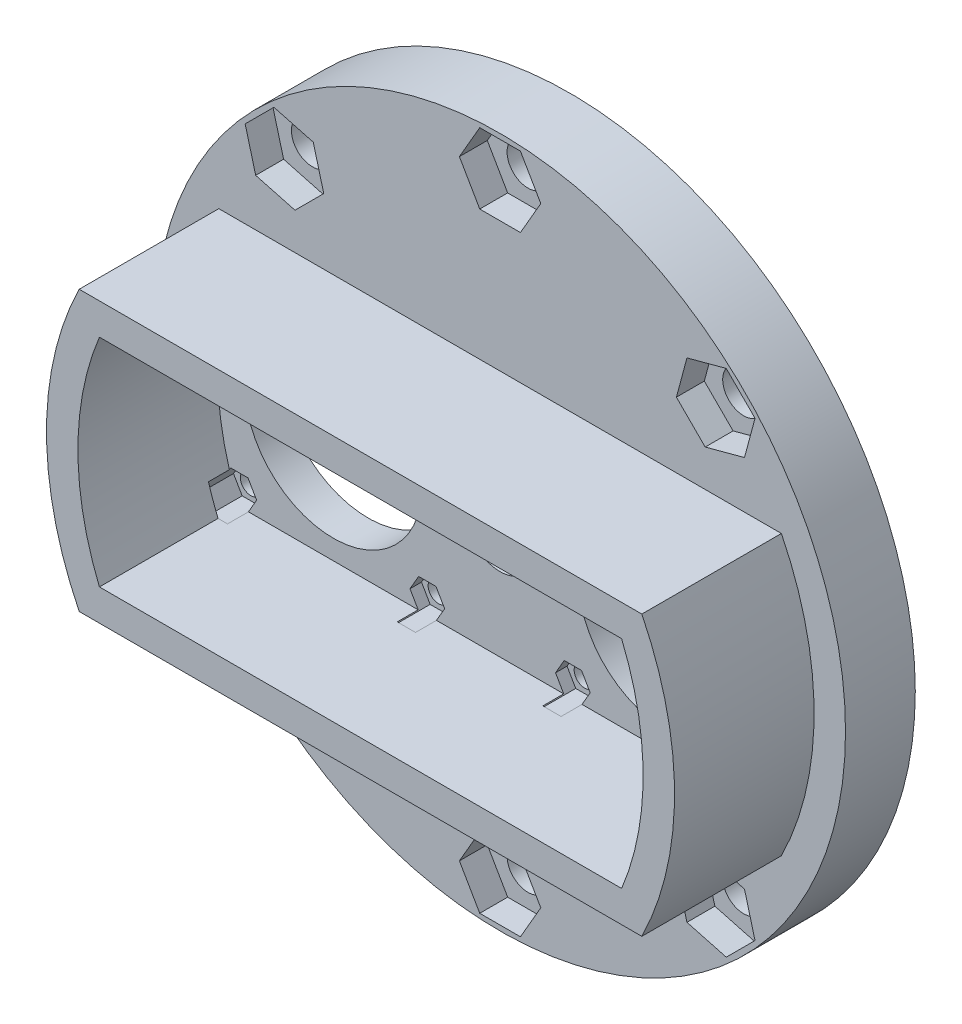
from build123d import *

# Parameters (mm, degrees)
SKETCH2_R               = 49.5
BOSS_EXTRUDE1_DEPTH     = 10
SKETCH1_R               = 1.5
SKETCH1_R_2             = 12.7
CUT_EXTRUDE1_DEPTH      = 5
SKETCH1_12_R            = 4.9
SKETCH1_12_R_2          = 2
CUT_EXTRUDE2_DEPTH      = 45
SKETCH1_13_R            = 1.5
CUT_EXTRUDE3_DEPTH      = 10
BOSS_EXTRUDE2_DEPTH     = 20
SKETCH5_R               = 3
CUT_EXTRUDE4_DEPTH      = 20
SKETCH6_R               = 3
CUT_EXTRUDE5_DEPTH      = 4
CUT_EXTRUDE6_DEPTH      = 3
CUT_EXTRUDE6_DEPTH_BACK = 1.65


with BuildPart() as part:
    # Sketch2 → Boss-Extrude1 (new body)
    with BuildSketch(Plane.XY):
        Circle(SKETCH2_R)
    extrude(amount=BOSS_EXTRUDE1_DEPTH)

    # Sketch1 → Cut-Extrude1 (cut)
    # profile 1 of 2: a face of its own
    with BuildSketch(Plane(origin=(0, 0, 0), x_dir=(-1, 0, 0), z_dir=(0, 0, 1))):
        with BuildLine():
            Line((-7, 14.240786495), (-7, -14.240786495))
            ThreePointArc((-7, -14.240786495), (-23.9, -22.1), (-40.8, -14.240786495))
            Line((-40.8, -14.240786495), (-40.8, 14.240786495))
            ThreePointArc((-40.8, 14.240786495), (-23.9, 22.1), (-7, 14.240786495))
        make_face()
        with Locations(Location((-37.370384182, 13.470384182, 0), (0, 0, 180))):
            Circle(SKETCH1_R, mode=Mode.SUBTRACT)
        with Locations(Location((-10.464971157, 13.435028843, 0), (0, 0, 180))):
            Circle(SKETCH1_R, mode=Mode.SUBTRACT)
        with Locations(Location((-10.464971157, -13.435028843, 0), (0, 0, 180))):
            Circle(SKETCH1_R, mode=Mode.SUBTRACT)
        with Locations(Location((-37.370384182, -13.470384182, 0), (0, 0, 180))):
            Circle(SKETCH1_R, mode=Mode.SUBTRACT)
        with Locations(Location((-23.9, 0, 0), (0, 0, 180))):
            Circle(SKETCH1_R_2, mode=Mode.SUBTRACT)
    # profile 2 of 2: a face of its own
    with BuildSketch(Plane(origin=(0, 0, 0), x_dir=(-1, 0, 0), z_dir=(0, 0, 1))):
        with BuildLine():
            Line((7, 14.240786495), (7, -14.240786495))
            ThreePointArc((7, -14.240786495), (23.9, -22.1), (40.8, -14.240786495))
            Line((40.8, -14.240786495), (40.8, 14.240786495))
            ThreePointArc((40.8, 14.240786495), (23.9, 22.1), (7, 14.240786495))
        make_face()
        with Locations(Location((10.464971157, 13.435028843, 0), (0, 0, 180))):
            Circle(SKETCH1_R, mode=Mode.SUBTRACT)
        with Locations(Location((10.464971157, -13.435028843, 0), (0, 0, 180))):
            Circle(SKETCH1_R, mode=Mode.SUBTRACT)
        with Locations(Location((37.370384182, -13.470384182, 0), (0, 0, 180))):
            Circle(SKETCH1_R, mode=Mode.SUBTRACT)
        with Locations(Location((37.370384182, 13.470384182, 0), (0, 0, 180))):
            Circle(SKETCH1_R, mode=Mode.SUBTRACT)
        with Locations(Location((23.9, 0, 0), (0, 0, 180))):
            Circle(SKETCH1_R_2, mode=Mode.SUBTRACT)
    extrude(amount=CUT_EXTRUDE1_DEPTH, mode=Mode.SUBTRACT)

    # Sketch1<12> → Cut-Extrude2 (cut)
    with BuildSketch(Plane(origin=(0, 0, 0), x_dir=(-1, 0, 0), z_dir=(0, 0, 1))):
        Circle(SKETCH1_12_R)
        with Locations((0, 35)):
            Circle(SKETCH1_12_R_2)
        with BuildLine():
            Line((-11.2, 0), (-23.9, 0))
            Line((-23.9, 0), (-36.6, 0))
            ThreePointArc((-36.6, 0), (-23.9, -12.7), (-11.2, 0))
        make_face()
        with BuildLine():
            Line((-14.919743879, 8.980256121), (-23.9, 0))
            Line((-23.9, 0), (-11.2, 0))
            ThreePointArc((-11.2, 0), (-12.166729937, 4.860079591), (-14.919743879, 8.980256121))
        make_face()
        with BuildLine():
            Line((-32.880256121, 8.980256121), (-23.9, 0))
            Line((-23.9, 0), (-14.919743879, 8.980256121))
            ThreePointArc((-14.919743879, 8.980256121), (-23.9, 12.7), (-32.880256121, 8.980256121))
        make_face()
        with BuildLine():
            Line((-36.6, 0), (-23.9, 0))
            Line((-23.9, 0), (-32.880256121, 8.980256121))
            ThreePointArc((-32.880256121, 8.980256121), (-35.633270063, 4.860079591), (-36.6, 0))
        make_face()
        with BuildLine():
            Line((11.2, 0), (23.9, 0))
            Line((23.9, 0), (36.6, 0))
            ThreePointArc((36.6, 0), (23.9, 12.7), (11.2, 0))
        make_face()
        with BuildLine():
            Line((36.6, 0), (23.9, 0))
            Line((23.9, 0), (11.2, 0))
            ThreePointArc((11.2, 0), (23.9, -12.7), (36.6, 0))
        make_face()
    extrude(amount=CUT_EXTRUDE2_DEPTH, mode=Mode.SUBTRACT)

    # Sketch1<13> → Cut-Extrude3 (cut)
    with BuildSketch(Plane(origin=(0, 0, 0), x_dir=(-1, 0, 0), z_dir=(0, 0, 1))):
        with Locations(Location((-37.370384182, 13.470384182, 0), (0, 0, 180))):
            Circle(SKETCH1_13_R)
        with Locations(Location((-10.464971157, 13.435028843, 0), (0, 0, 180))):
            Circle(SKETCH1_13_R)
        with Locations(Location((-10.464971157, -13.435028843, 0), (0, 0, 180))):
            Circle(SKETCH1_13_R)
        with Locations(Location((-37.370384182, -13.470384182, 0), (0, 0, 180))):
            Circle(SKETCH1_13_R)
        with Locations(Location((10.464971157, 13.435028843, 0), (0, 0, 180))):
            Circle(SKETCH1_13_R)
        with Locations(Location((10.464971157, -13.435028843, 0), (0, 0, 180))):
            Circle(SKETCH1_13_R)
        with Locations(Location((37.370384182, -13.470384182, 0), (0, 0, 180))):
            Circle(SKETCH1_13_R)
        with Locations(Location((37.370384182, 13.470384182, 0), (0, 0, 180))):
            Circle(SKETCH1_13_R)
    extrude(amount=CUT_EXTRUDE3_DEPTH, mode=Mode.SUBTRACT)

    # Sketch4 → Boss-Extrude2 (add)
    with BuildSketch(Plane.XY.offset(10)):
        with BuildLine():
            Line((-40.311288741, -20), (40.311288741, -20))
            ThreePointArc((40.311288741, -20), (45, 0), (40.311288741, 20))
            Line((40.311288741, 20), (-40.311288741, 20))
            ThreePointArc((-40.311288741, 20), (-45, 0), (-40.311288741, -20))
        make_face()
        with BuildLine():
            Line((37.416573868, -15.5), (-37.416573868, -15.5))
            ThreePointArc((-37.416573868, -15.5), (-40.5, 0), (-37.416573868, 15.5))
            Line((-37.416573868, 15.5), (37.416573868, 15.5))
            ThreePointArc((37.416573868, 15.5), (40.5, 0), (37.416573868, -15.5))
        make_face(mode=Mode.SUBTRACT)
    extrude(amount=BOSS_EXTRUDE2_DEPTH)

    # Sketch5 → Cut-Extrude4 (cut)
    with BuildSketch(Plane.XY.offset(10)):
        with Locations((0, 43.7)):
            Circle(SKETCH5_R)
        with Locations((30.900566338, 30.900566338)):
            Circle(SKETCH5_R)
        with Locations((30.900566338, -30.900566338)):
            Circle(SKETCH5_R)
        with Locations((0, -43.7)):
            Circle(SKETCH5_R)
        with Locations((-30.900566338, -30.900566338)):
            Circle(SKETCH5_R)
        with Locations((-30.900566338, 30.900566338)):
            Circle(SKETCH5_R)
    extrude(amount=-CUT_EXTRUDE4_DEPTH, mode=Mode.SUBTRACT)

    # Sketch6 → Cut-Extrude5 (cut)
    # profile 1 of 6: a face of its own
    with BuildSketch(Plane.XY.offset(10)):
        Polygon((-2.915618859, 38.65), (2.915618859, 38.65), (5.831237719, 43.7), (2.915618859, 48.75), (-2.915618859, 48.75), (-5.831237719, 43.7), align=None)
        with Locations((0, 43.7)):
            Circle(SKETCH6_R, mode=Mode.SUBTRACT)
    # profile 2 of 6: a face of its own
    with BuildSketch(Plane.XY.offset(10)):
        Polygon((25.268023226, 29.39133096), (29.39133096, 25.268023226), (35.023874072, 26.777258604), (36.53310945, 32.409801716), (32.409801716, 36.53310945), (26.777258604, 35.023874072), align=None)
        with Locations((30.900566338, 30.900566338)):
            Circle(SKETCH6_R, mode=Mode.SUBTRACT)
    # profile 3 of 6: a face of its own
    with BuildSketch(Plane.XY.offset(10)):
        Polygon((29.39133096, -25.268023226), (25.268023226, -29.39133096), (26.777258604, -35.023874072), (32.409801716, -36.53310945), (36.53310945, -32.409801716), (35.023874072, -26.777258604), align=None)
        with Locations((30.900566338, -30.900566338)):
            Circle(SKETCH6_R, mode=Mode.SUBTRACT)
    # profile 4 of 6: a face of its own
    with BuildSketch(Plane.XY.offset(10)):
        Polygon((2.915618859, -38.65), (-2.915618859, -38.65), (-5.831237719, -43.7), (-2.915618859, -48.75), (2.915618859, -48.75), (5.831237719, -43.7), align=None)
        with Locations((0, -43.7)):
            Circle(SKETCH6_R, mode=Mode.SUBTRACT)
    # profile 5 of 6: a face of its own
    with BuildSketch(Plane.XY.offset(10)):
        Polygon((-25.268023226, -29.39133096), (-29.39133096, -25.268023226), (-35.023874072, -26.777258604), (-36.53310945, -32.409801716), (-32.409801716, -36.53310945), (-26.777258604, -35.023874072), align=None)
        with Locations((-30.900566338, -30.900566338)):
            Circle(SKETCH6_R, mode=Mode.SUBTRACT)
    # profile 6 of 6: a face of its own
    with BuildSketch(Plane.XY.offset(10)):
        Polygon((-26.777258604, 35.023874072), (-32.409801716, 36.53310945), (-36.53310945, 32.409801716), (-35.023874072, 26.777258604), (-29.39133096, 25.268023226), (-25.268023226, 29.39133096), align=None)
    extrude(amount=-CUT_EXTRUDE5_DEPTH, mode=Mode.SUBTRACT)

    # Sketch7 → Cut-Extrude6 (cut, two sides: drawn at the far end of the back side and taken through both)
    with BuildSketch(Plane.XY.offset(10).offset(-CUT_EXTRUDE6_DEPTH_BACK)):
        Polygon((-34.887778024, 13.470384182), (-36.129081103, 15.620384182), (-38.61168726, 15.620384182), (-39.852990339, 13.470384182), (-38.61168726, 11.320384182), (-36.129081103, 11.320384182), align=None)
        Polygon((-9.18831274, -11.320384182), (-11.670918897, -11.320384182), (-12.912221976, -13.470384182), (-11.670918897, -15.620384182), (-9.18831274, -15.620384182), (-7.947009661, -13.470384182), align=None)
        Polygon((-36.129081103, -11.320384182), (-34.887778024, -13.470384182), (-36.129081103, -15.620384182), (-38.61168726, -15.620384182), (-39.852990339, -13.470384182), (-38.61168726, -11.320384182), align=None)
        Polygon((36.129081103, 11.320384182), (34.887778024, 13.470384182), (36.129081103, 15.620384182), (38.61168726, 15.620384182), (39.852990339, 13.470384182), (38.61168726, 11.320384182), align=None)
        Polygon((9.18831274, 11.320384182), (11.670918897, 11.320384182), (12.912221976, 13.470384182), (11.670918897, 15.620384182), (9.18831274, 15.620384182), (7.947009661, 13.470384182), align=None)
        Polygon((7.947009661, -13.470384182), (9.18831274, -11.320384182), (11.670918897, -11.320384182), (12.912221976, -13.470384182), (11.670918897, -15.620384182), (9.18831274, -15.620384182), align=None)
        Polygon((38.61168726, -11.320384182), (36.129081103, -11.320384182), (34.887778024, -13.470384182), (36.129081103, -15.620384182), (38.61168726, -15.620384182), (39.852990339, -13.470384182), align=None)
    extrude(amount=CUT_EXTRUDE6_DEPTH + CUT_EXTRUDE6_DEPTH_BACK, mode=Mode.SUBTRACT)


solid = part.part
